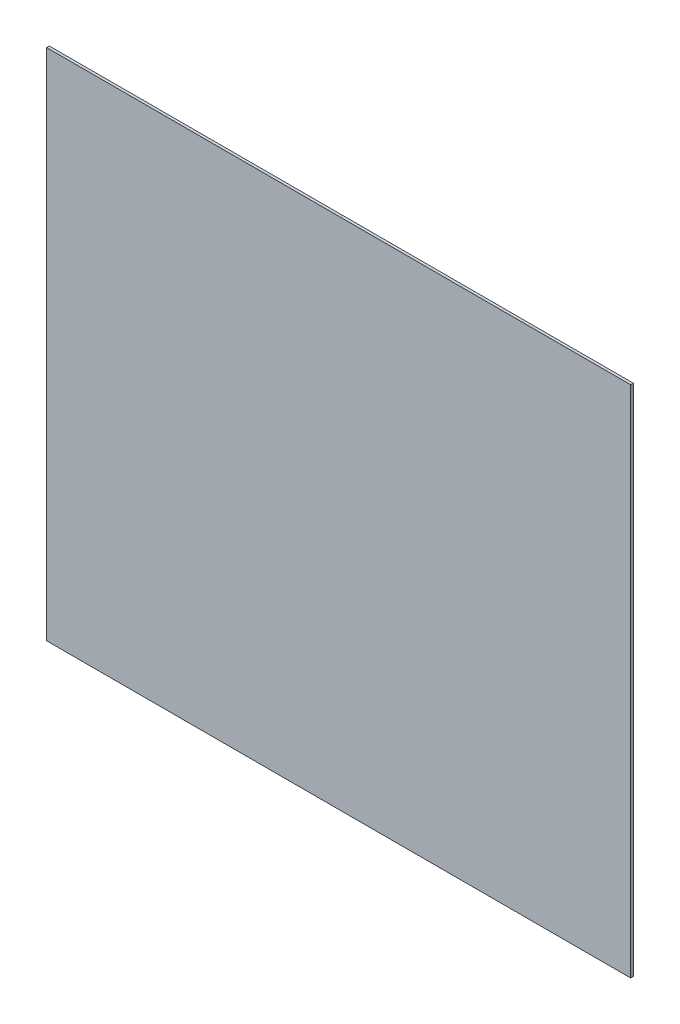
from build123d import *

# Parameters (mm, degrees)
SKETCH1_W           = 864
SKETCH1_H           = 760
BOSS_EXTRUDE1_DEPTH = 4


with BuildPart() as part:
    # Sketch1 → Boss-Extrude1 (new body)
    with BuildSketch(Plane.XY):
        Rectangle(SKETCH1_W, SKETCH1_H)
    extrude(amount=BOSS_EXTRUDE1_DEPTH)


solid = part.part
